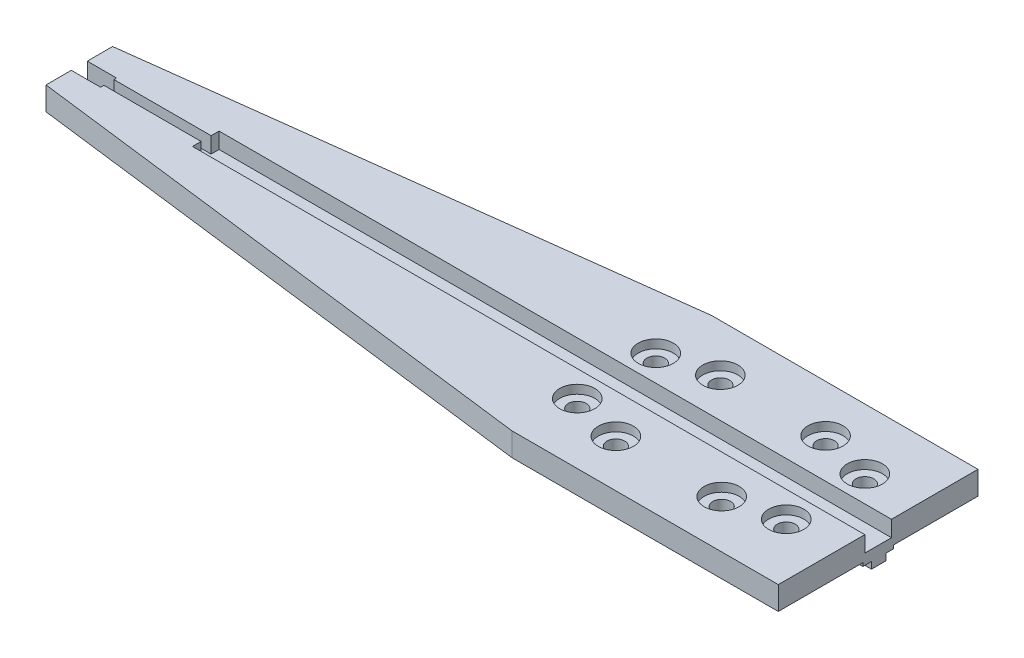
from build123d import *

# Parameters (mm, degrees)
SKETCH2_W                       = 38.1
SKETCH2_H                       = 6.35
BOSS_EXTRUDE1_DEPTH             = 152.4
CBORE_FOR_M3_SBHCS1_D           = 3.4
CBORE_FOR_M3_SBHCS1_CBORE_D     = 6.7
CBORE_FOR_M3_SBHCS1_CBORE_DEPTH = 1.65
SKETCH9_W                       = 3.048
SKETCH9_H                       = 3.048
CUT_EXTRUDE1_DEPTH              = 5.588
SKETCH12_W                      = 128.27
SKETCH12_H                      = 5.08
CUT_EXTRUDE2_DEPTH              = 3.048
SKETCH13_W                      = 18.542
SKETCH13_H                      = 1.905
CUT_EXTRUDE3_DEPTH              = 3.048
CUT_EXTRUDE4_DEPTH              = 6.35
CUT_EXTRUDE5_DEPTH              = 6.35
CUT_EXTRUDE7_DEPTH              = 154.618824123
CUT_EXTRUDE7_DEPTH_BACK         = 59.944
SKETCH19_W                      = 38.1
SKETCH19_H                      = 2.032
CUT_EXTRUDE9_DEPTH              = 92.456


with BuildPart() as part:
    # Sketch2 → Boss-Extrude1 (new body)
    with BuildSketch(Plane(origin=(0, 0, 0), x_dir=(0, 0, -1), z_dir=(1, 0, 0))):
        Rectangle(SKETCH2_W, SKETCH2_H)
    extrude(amount=BOSS_EXTRUDE1_DEPTH)

    # CBORE for M3 SBHCS1 (through all)
    with Locations(Plane(origin=(0, 3.175, 0), x_dir=(1, 0, 0), z_dir=(0, 1, 0))):
        with Locations((142.367, -7.493), (142.367, 7.493), (102.489, 7.493), (102.489, -7.493), (132.334, 10.033), (112.268, 10.032595549), (112.395401903, -10.033), (132.461, -9.906)):
            CounterBoreHole(CBORE_FOR_M3_SBHCS1_D / 2, CBORE_FOR_M3_SBHCS1_CBORE_D / 2, CBORE_FOR_M3_SBHCS1_CBORE_DEPTH)

    # Sketch9 → Cut-Extrude1 (cut)
    with BuildSketch(Plane.ZY):
        with Locations((0, 1.651)):
            Rectangle(SKETCH9_W, SKETCH9_H)
    extrude(amount=-CUT_EXTRUDE1_DEPTH, mode=Mode.SUBTRACT)

    # Sketch12 → Cut-Extrude2 (cut)
    with BuildSketch(Plane(origin=(0, 3.175, 0), x_dir=(1, 0, 0), z_dir=(0, 1, 0))):
        with Locations((88.265, 0)):
            Rectangle(SKETCH12_W, SKETCH12_H)
    extrude(amount=-CUT_EXTRUDE2_DEPTH, mode=Mode.SUBTRACT)

    # Sketch13 → Cut-Extrude3 (cut)
    with BuildSketch(Plane(origin=(0, 3.175, 0), x_dir=(1, 0, 0), z_dir=(0, 1, 0))):
        with Locations((14.859, 0.0635)):
            Rectangle(SKETCH13_W, SKETCH13_H)
    extrude(amount=-CUT_EXTRUDE3_DEPTH, mode=Mode.SUBTRACT)

    # Sketch14 → Cut-Extrude4 (cut)
    with BuildSketch(Plane(origin=(0, 3.175, 0), x_dir=(1, 0, 0), z_dir=(0, 1, 0))):
        Polygon((0, 6.35), (0, 19.05), (101.6, 19.05), align=None)
    extrude(amount=-CUT_EXTRUDE4_DEPTH, mode=Mode.SUBTRACT)

    # Sketch15 → Cut-Extrude5 (cut)
    with BuildSketch(Plane(origin=(0, 3.175, 0), x_dir=(1, 0, 0), z_dir=(0, 1, 0))):
        Polygon((0, -6.35), (101.6, -19.05), (0, -19.05), align=None)
    extrude(amount=-CUT_EXTRUDE5_DEPTH, mode=Mode.SUBTRACT)

    # Sketch17 → Cut-Extrude7 (cut, two sides: drawn at the far end of the back side and taken through both)
    with BuildSketch(Plane(origin=(152.4, 0, 0), x_dir=(0, 0, -1), z_dir=(1, 0, 0)).offset(-CUT_EXTRUDE7_DEPTH_BACK)):
        Polygon((-105.766830618, -1.27), (-19.05, -1.27), (-2.921, -1.27), (-2.921, -1.905), (-1.27, -1.905), (-1.27, -3.175), (1.524, -3.175), (1.524, -1.905), (2.921, -1.905), (2.921, -1.27), (19.05, -1.27), (105.766830618, -1.27), (105.766830618, -174.703661235), (-105.766830618, -174.703661235), align=None)
    extrude(amount=CUT_EXTRUDE7_DEPTH + CUT_EXTRUDE7_DEPTH_BACK, mode=Mode.SUBTRACT)

    # Sketch19 → Cut-Extrude9 (cut)
    with BuildSketch(Plane.ZY):
        with Locations((0, -2.286)):
            Rectangle(SKETCH19_W, SKETCH19_H)
    extrude(amount=-CUT_EXTRUDE9_DEPTH, mode=Mode.SUBTRACT)


solid = part.part
